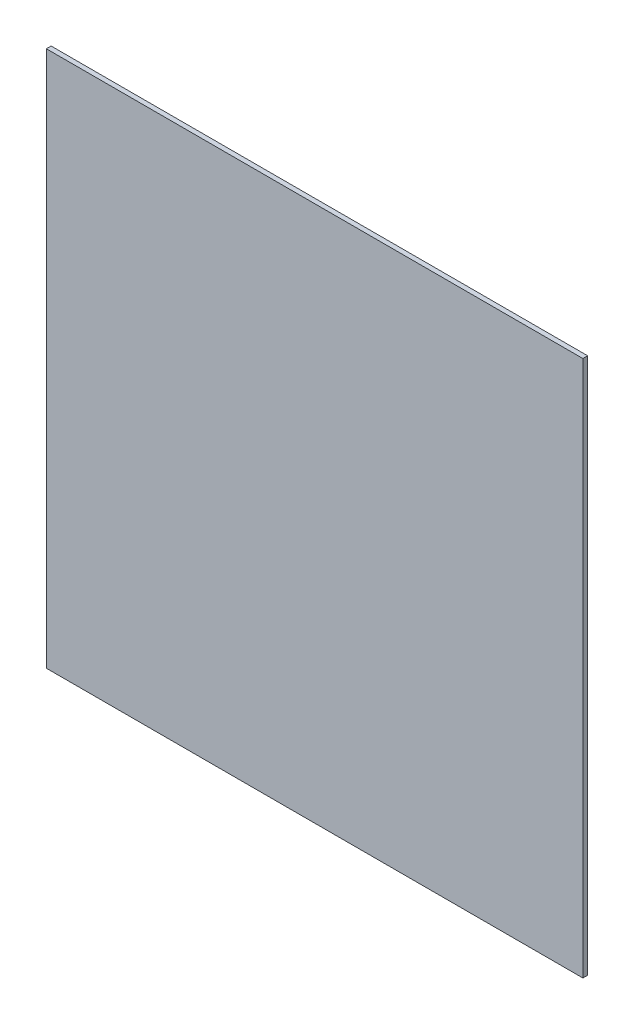
from build123d import *

# Parameters (mm, degrees)
SKETCH1_W           = 224.6
SKETCH1_H           = 224.6
BOSS_EXTRUDE1_DEPTH = 2


with BuildPart() as part:
    # Sketch1 → Boss-Extrude1 (new body)
    with BuildSketch(Plane.XY):
        Rectangle(SKETCH1_W, SKETCH1_H)
    extrude(amount=BOSS_EXTRUDE1_DEPTH)


solid = part.part
